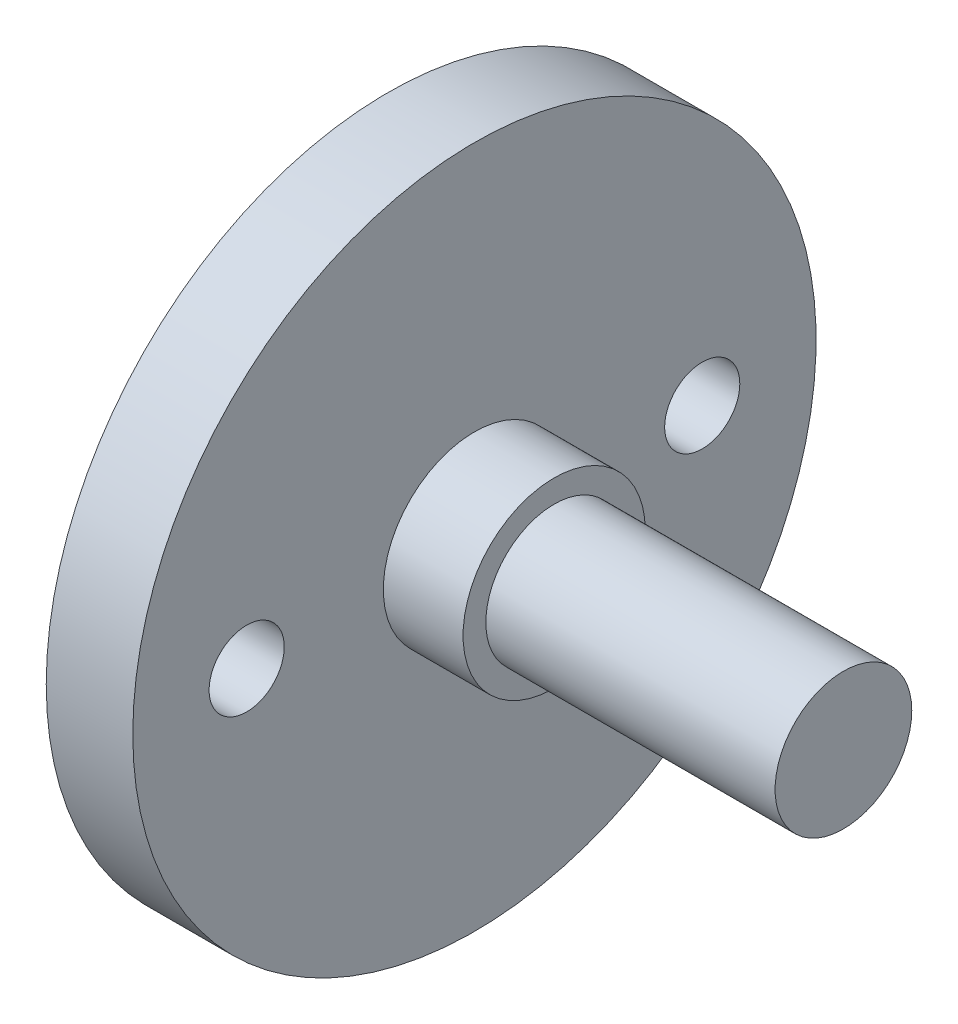
from build123d import *

# Parameters (mm, degrees)
SKETCH_1_R          = 15
EXTRUDE_1_DEPTH     = 10.8
SKETCH_2_R          = 4
EXTRUDE_2_DEPTH     = 3.5
SKETCH_3_R          = 3
EXTRUDE_3_DEPTH     = 5.8
SKETCH_4_R          = 1.65
CUT_EXTRUDE_1_DEPTH = 30.223449488
SKETCH_5_R          = 3
EXTRUDE_4_DEPTH     = 6.9
SKETCH_6_R          = 15
CUT_EXTRUDE_2_DEPTH = 7


with BuildPart() as part:
    # ｽｹｯﾁ1 → ﾎﾞｽ - 押し出し1 (new body)
    with BuildSketch(Plane(origin=(0, 0, 0), x_dir=(0, 0, -1), z_dir=(1, 0, 0))):
        with Locations(Location((0, 0, 0), (0, 0, 180))):
            Circle(SKETCH_1_R)
    extrude(amount=EXTRUDE_1_DEPTH)

    # ｽｹｯﾁ2 → ﾎﾞｽ - 押し出し2 (add)
    with BuildSketch(Plane(origin=(10.8, 0, 0), x_dir=(0, 0, -1), z_dir=(1, 0, 0))):
        Circle(SKETCH_2_R)
    extrude(amount=EXTRUDE_2_DEPTH)

    # ｽｹｯﾁ3 → ﾎﾞｽ - 押し出し3 (add)
    with BuildSketch(Plane(origin=(14.3, 0, 0), x_dir=(0, 0, -1), z_dir=(1, 0, 0))):
        Circle(SKETCH_3_R)
    extrude(amount=EXTRUDE_3_DEPTH)

    # ｽｹｯﾁ4 → ｶｯﾄ - 押し出し1 (cut, through all)
    with BuildSketch(Plane.ZY):
        with Locations((10, 0)):
            Circle(SKETCH_4_R)
        with Locations(Location((-10, 0, 0), (0, 0, 180))):
            Circle(SKETCH_4_R)
    extrude(amount=-CUT_EXTRUDE_1_DEPTH, mode=Mode.SUBTRACT)

    # ｽｹｯﾁ5 → ﾎﾞｽ - 押し出し4 (add)
    with BuildSketch(Plane(origin=(20.1, 0, 0), x_dir=(0, 0, -1), z_dir=(1, 0, 0))):
        Circle(SKETCH_5_R)
    extrude(amount=EXTRUDE_4_DEPTH)

    # ｽｹｯﾁ6 → ｶｯﾄ - 押し出し2 (cut)
    with BuildSketch(Plane.ZY):
        Circle(SKETCH_6_R)
    extrude(amount=-CUT_EXTRUDE_2_DEPTH, mode=Mode.SUBTRACT)


solid = part.part
